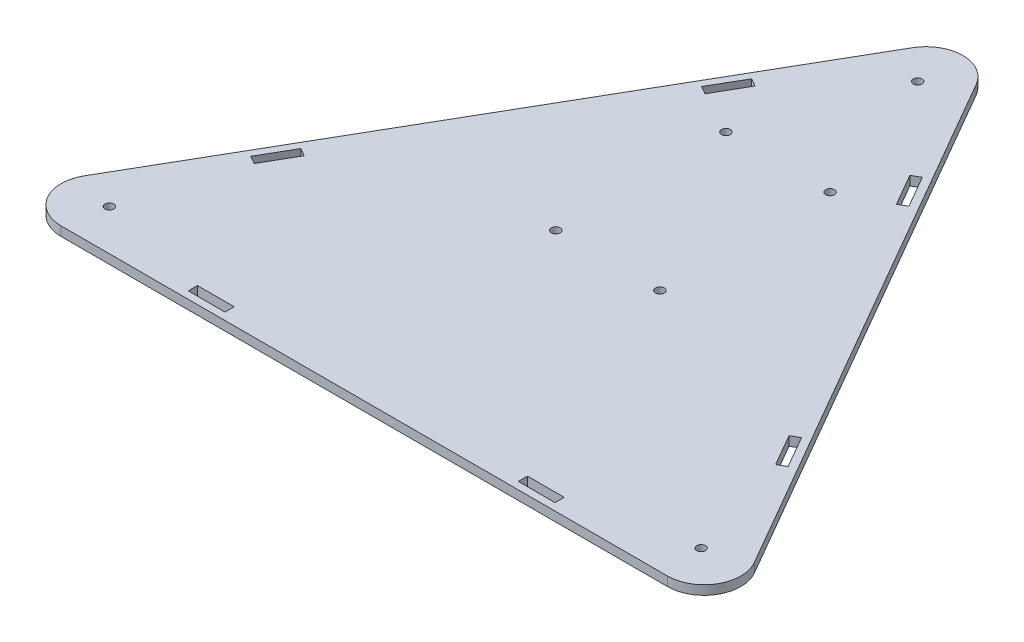
from build123d import *

# Parameters (mm, degrees)
BOSS_EXTRUDE1_DEPTH = 3.175
SKETCH2_R           = 1.524
CUT_EXTRUDE2_DEPTH  = 195.021684248
FILLET1_R           = 12.7
SKETCH3_W           = 12.7
SKETCH3_H           = 3.175
CUT_EXTRUDE3_DEPTH  = 179.341965104
SKETCH4_R           = 1.524
CUT_EXTRUDE4_DEPTH  = 179.341965104


with BuildPart() as part:
    # Sketch1 → Boss-Extrude1 (new body)
    with BuildSketch(Plane(origin=(0, 0, 0), x_dir=(1, 0, 0), z_dir=(0, 1, 0))):
        Polygon((0, 146.646968374), (-127, -73.323484187), (127, -73.323484187), align=None)
    extrude(amount=BOSS_EXTRUDE1_DEPTH)

    # Sketch2 → Cut-Extrude2 (cut, through all)
    with BuildSketch(Plane(origin=(0, 3.175, 0), x_dir=(1, 0, 0), z_dir=(0, 1, 0))):
        with Locations((-102.461318102, -59.156069588)):
            Circle(SKETCH2_R)
        with Locations((102.461318102, -59.156069588)):
            Circle(SKETCH2_R)
        with Locations((0, 118.312139176)):
            Circle(SKETCH2_R)
    extrude(amount=-CUT_EXTRUDE2_DEPTH, mode=Mode.SUBTRACT)

    # Fillet1
    fillet1_edges = [part.edges().sort_by_distance(p)[0] for p in [
        (-127, 1.5875, 73.323484187),
        (0, 1.5875, -146.646968374),
        (127, 1.5875, 73.323484187),
    ]]
    fillet(fillet1_edges, radius=FILLET1_R)

    # Sketch3 → Cut-Extrude3 (cut, through all)
    with BuildSketch(Plane(origin=(0, 3.175, 0), x_dir=(1, 0, 0), z_dir=(0, 1, 0))):
        Polygon((93.050295474, -19.600871047), (86.700295474, -8.602348419), (83.950664817, -10.189848419), (90.300664817, -21.188371047), align=None)
        Polygon((33.150664817, 77.798332606), (35.900295474, 79.385832606), (29.550295474, 90.384355234), (26.800664817, 88.796855234), align=None)
        with Locations((-57.15, -69.195984187)):
            Rectangle(SKETCH3_W, SKETCH3_H)
        with Locations((57.15, -69.195984187)):
            Rectangle(SKETCH3_W, SKETCH3_H)
        Polygon((-29.550295474, 90.384355234), (-35.900295474, 79.385832606), (-33.150664817, 77.798332606), (-26.800664817, 88.796855234), align=None)
        Polygon((-83.950664817, -10.189848419), (-86.700295474, -8.602348419), (-93.050295474, -19.600871047), (-90.300664817, -21.188371047), align=None)
    extrude(amount=-CUT_EXTRUDE3_DEPTH, mode=Mode.SUBTRACT)

    # Sketch4 → Cut-Extrude4 (cut, through all)
    with BuildSketch(Plane(origin=(0, 3.175, 0), x_dir=(1, 0, 0), z_dir=(0, 1, 0))):
        with Locations((-18.034, 69.940515813)):
            Circle(SKETCH4_R)
        with Locations((18.034, 69.940515813)):
            Circle(SKETCH4_R)
        with Locations((-18.034, 11.012515813)):
            Circle(SKETCH4_R)
        with Locations((18.034, 11.012515813)):
            Circle(SKETCH4_R)
    extrude(amount=-CUT_EXTRUDE4_DEPTH, mode=Mode.SUBTRACT)


solid = part.part
